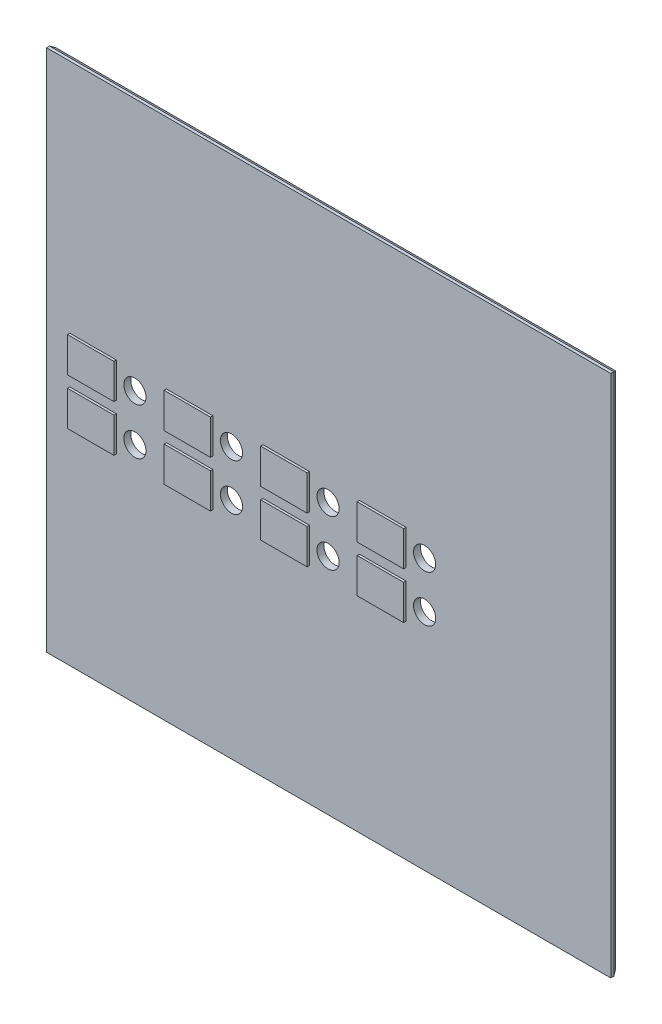
from build123d import *

# Parameters (mm, degrees)
ESBO_O1_W                 = 485
ESBO_O1_H                 = 450
RESSALTO_EXTRUS_O1_DEPTH  = 6
ESBO_O2_W                 = 39.943598922
ESBO_O2_H                 = 30
RESSALTO_EXTRUS_O2_DEPTH  = 2
PADR_O_LINEAR1_COUNT      = 4
PADR_O_LINEAR1_PITCH      = 83
PADR_O_LINEAR1_COUNT_DIR2 = 2
PADR_O_LINEAR1_PITCH_DIR2 = 40
ESBO_O3_R                 = 9.525
CORTE_EXTRUS_O1_DEPTH     = 331.858353378
PADR_O_LINEAR2_COUNT      = 4
PADR_O_LINEAR2_PITCH      = 83
PADR_O_LINEAR2_COUNT_DIR2 = 2
PADR_O_LINEAR2_PITCH_DIR2 = 40
CHANFRO1_SIZE             = 2
CHANFRO1_SIZE2            = 3.464101615


with BuildPart() as part:
    # Esboço1 → Ressalto-extrusão1 (new body)
    with BuildSketch(Plane.XY):
        Rectangle(ESBO_O1_W, ESBO_O1_H)
    extrude(amount=RESSALTO_EXTRUS_O1_DEPTH)

    # Esboço2 → Ressalto-extrusão2 (add)
    with BuildSketch(Plane.XY.offset(6)):
        with Locations((-202.528200539, 7.5)):
            Rectangle(ESBO_O2_W, ESBO_O2_H)
    ressalto_extrus_o2 = extrude(amount=RESSALTO_EXTRUS_O2_DEPTH)

    # Padrão linear1: Ressalto-extrus_o2 4 × 2
    with Locations(*[(i * PADR_O_LINEAR1_PITCH, -j * PADR_O_LINEAR1_PITCH_DIR2, 0) for i in range(PADR_O_LINEAR1_COUNT) for j in range(PADR_O_LINEAR1_COUNT_DIR2) if (i, j) != (0, 0)]):
        add(ressalto_extrus_o2)

    # Esboço3 → Corte-extrusão1 (cut, through all)
    with BuildSketch(Plane.XY.offset(6)):
        with Locations((-166.556401078, 7.5)):
            Circle(ESBO_O3_R)
    corte_extrus_o1 = extrude(amount=-CORTE_EXTRUS_O1_DEPTH, mode=Mode.SUBTRACT)

    # Padrão linear2: Corte-extrus_o1 4 × 2
    with Locations(*[(i * PADR_O_LINEAR2_PITCH, -j * PADR_O_LINEAR2_PITCH_DIR2, 0) for i in range(PADR_O_LINEAR2_COUNT) for j in range(PADR_O_LINEAR2_COUNT_DIR2) if (i, j) != (0, 0)]):
        add(corte_extrus_o1, mode=Mode.SUBTRACT)

    # Chanfro1
    chanfro1_edges = [part.edges().sort_by_distance(p)[0] for p in [
        (0, 225, 0),
        (242.5, 0, 0),
        (0, -225, 0),
        (-242.5, 0, 0),
    ]]
    chanfro1_side = [part.faces().sort_by_distance(p)[0] for p in [
        (0, -218.383921101, 0),
    ]]
    chamfer(chanfro1_edges, length=CHANFRO1_SIZE, length2=CHANFRO1_SIZE2, reference=chanfro1_side[0])


solid = part.part
